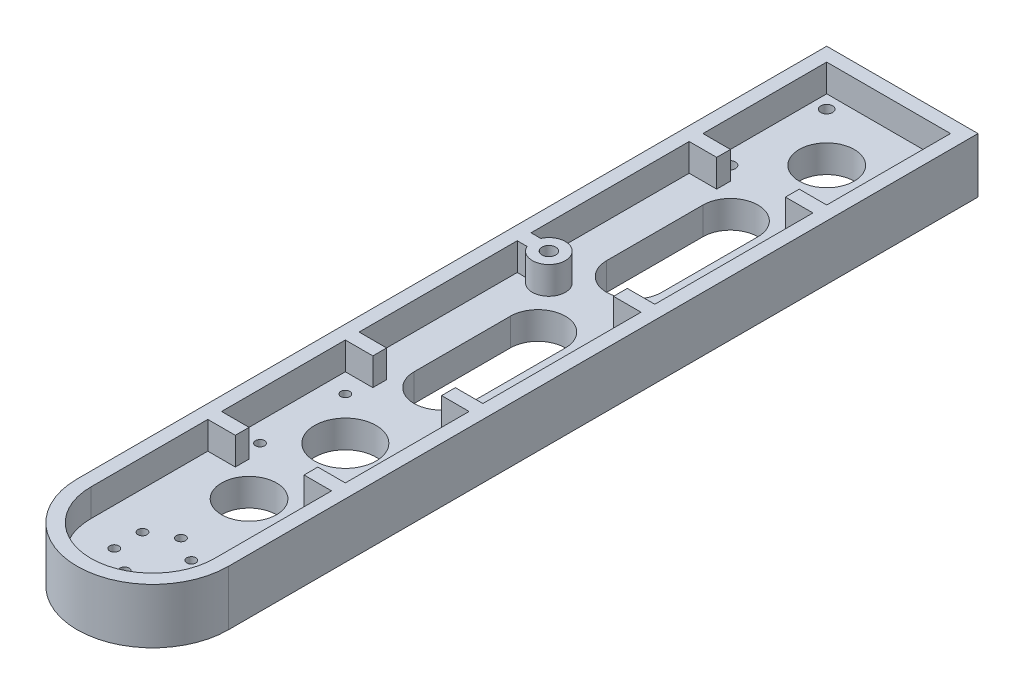
from build123d import *

# Parameters (mm, degrees)
SKETCH_1_R      = 1.65
SKETCH_1_R_2    = 2.15
SKETCH_1_R_3    = 10
SKETCH_1_R_4    = 11.2
SKETCH_1_R_5    = 2.65
EXTRUDE_1_DEPTH = 10
EXTRUDE_2_DEPTH = 10
SKETCH_4_W      = 10
SKETCH_4_H      = 5
SKETCH_4_R      = 2.5
EXTRUDE_3_DEPTH = 10


with BuildPart() as part:
    # 草图1 → 凸台-拉伸1 (new body)
    with BuildSketch(Plane(origin=(0, 0, 0), x_dir=(1, 0, 0), z_dir=(0, 1, 0))):
        with BuildLine():
            Line((-27.5, 0), (-27.5, 272.5))
            Line((-27.5, 272.5), (27.5, 272.5))
            Line((27.5, 272.5), (27.5, 0))
            ThreePointArc((27.5, 0), (0, -27.5), (-27.5, 0))
        make_face()
        with Locations(Location((0, 10.25, 0), (0, 0, 270))):
            Circle(SKETCH_1_R, mode=Mode.SUBTRACT)
        with Locations(Location((8.876760389, 5.125, 0), (0, 0, 270))):
            Circle(SKETCH_1_R, mode=Mode.SUBTRACT)
        with Locations(Location((8.876760389, -5.125, 0), (0, 0, 270))):
            Circle(SKETCH_1_R, mode=Mode.SUBTRACT)
        with Locations(Location((0, -10.25, 0), (0, 0, 270))):
            Circle(SKETCH_1_R, mode=Mode.SUBTRACT)
        with Locations(Location((-8.876760389, -5.125, 0), (0, 0, 270))):
            Circle(SKETCH_1_R, mode=Mode.SUBTRACT)
        with Locations(Location((-8.876760389, 5.125, 0), (0, 0, 270))):
            Circle(SKETCH_1_R, mode=Mode.SUBTRACT)
        with Locations(Location((-17.67766953, 262.67766953, 0), (0, 0, 270))):
            Circle(SKETCH_1_R_2, mode=Mode.SUBTRACT)
        with Locations(Location((17.67766953, 262.67766953, 0), (0, 0, 270))):
            Circle(SKETCH_1_R_2, mode=Mode.SUBTRACT)
        with Locations(Location((17.67766953, 227.32233047, 0), (0, 0, 270))):
            Circle(SKETCH_1_R_2, mode=Mode.SUBTRACT)
        with Locations(Location((-17.67766953, 227.32233047, 0), (0, 0, 270))):
            Circle(SKETCH_1_R_2, mode=Mode.SUBTRACT)
        with Locations(Location((0, 245, 0), (0, 0, 270))):
            Circle(SKETCH_1_R_3, mode=Mode.SUBTRACT)
        with Locations(Location((-15.5, 85.5, 0), (0, 0, 270))):
            Circle(SKETCH_1_R, mode=Mode.SUBTRACT)
        with Locations(Location((15.5, 85.5, 0), (0, 0, 270))):
            Circle(SKETCH_1_R, mode=Mode.SUBTRACT)
        with Locations(Location((15.5, 54.5, 0), (0, 0, 270))):
            Circle(SKETCH_1_R, mode=Mode.SUBTRACT)
        with Locations(Location((-15.5, 54.5, 0), (0, 0, 270))):
            Circle(SKETCH_1_R, mode=Mode.SUBTRACT)
        with Locations(Location((0, 70, 0), (0, 0, 270))):
            Circle(SKETCH_1_R_4, mode=Mode.SUBTRACT)
        with Locations(Location((0, 35, 0), (0, 0, 270))):
            Circle(SKETCH_1_R_3, mode=Mode.SUBTRACT)
        with Locations(Location((-13.5, 157.5, 0), (0, 0, 270))):
            Circle(SKETCH_1_R_5, mode=Mode.SUBTRACT)
        with BuildLine():
            Line((-10, 105), (-10, 140))
            ThreePointArc((-10, 140), (0, 150), (10, 140))
            Line((10, 140), (10, 105))
            ThreePointArc((10, 105), (0, 95), (-10, 105))
        make_face(mode=Mode.SUBTRACT)
        with BuildLine():
            Line((-10, 175), (-10, 210))
            ThreePointArc((-10, 210), (0, 220), (10, 210))
            Line((10, 210), (10, 175))
            ThreePointArc((10, 175), (0, 165), (-10, 175))
        make_face(mode=Mode.SUBTRACT)
    extrude(amount=EXTRUDE_1_DEPTH)

    # 草图2 → 凸台-拉伸2 (add)
    with BuildSketch(Plane(origin=(0, 10, 0), x_dir=(1, 0, 0), z_dir=(0, 1, 0))):
        with BuildLine():
            Line((-27.5, 272.5), (-27.5, 0))
            ThreePointArc((-27.5, 0), (0, -27.5), (27.5, 0))
            Line((27.5, 0), (27.5, 272.5))
            Line((27.5, 272.5), (-27.5, 272.5))
        make_face()
        with BuildLine():
            ThreePointArc((-22.5, 0), (0, -22.5), (22.5, 0))
            Line((22.5, 0), (22.5, 222.5))
            Line((22.5, 222.5), (22.5, 267.5))
            Line((22.5, 267.5), (-22.5, 267.5))
            Line((-22.5, 267.5), (-22.5, 222.5))
            Line((-22.5, 222.5), (-22.5, 0))
        make_face(mode=Mode.SUBTRACT)
    extrude(amount=EXTRUDE_2_DEPTH)

    # 草图4 → 凸台-拉伸3 (add)
    # profile 1 of 8: a face of its own
    with BuildSketch(Plane(origin=(0, 10, 0), x_dir=(1, 0, 0), z_dir=(0, 1, 0))):
        with Locations((-17.5, 95)):
            Rectangle(SKETCH_4_W, SKETCH_4_H)
    # profile 2 of 8: a face of its own
    with BuildSketch(Plane(origin=(0, 10, 0), x_dir=(1, 0, 0), z_dir=(0, 1, 0))):
        with Locations((-17.5, 220)):
            Rectangle(SKETCH_4_W, SKETCH_4_H)
    # profile 3 of 8: a face of its own
    with BuildSketch(Plane(origin=(0, 10, 0), x_dir=(1, 0, 0), z_dir=(0, 1, 0))):
        with Locations((17.5, 220)):
            Rectangle(SKETCH_4_W, SKETCH_4_H)
    # profile 4 of 8: a face of its own
    with BuildSketch(Plane(origin=(0, 10, 0), x_dir=(1, 0, 0), z_dir=(0, 1, 0))):
        with Locations((17.5, 95)):
            Rectangle(SKETCH_4_W, SKETCH_4_H)
    # profile 5 of 8: a face of its own
    with BuildSketch(Plane(origin=(0, 10, 0), x_dir=(1, 0, 0), z_dir=(0, 1, 0))):
        with Locations((-17.5, 45)):
            Rectangle(SKETCH_4_W, SKETCH_4_H)
    # profile 6 of 8: a face of its own
    with BuildSketch(Plane(origin=(0, 10, 0), x_dir=(1, 0, 0), z_dir=(0, 1, 0))):
        with Locations((17.5, 45)):
            Rectangle(SKETCH_4_W, SKETCH_4_H)
    # profile 7 of 8: a face of its own
    with BuildSketch(Plane(origin=(0, 10, 0), x_dir=(1, 0, 0), z_dir=(0, 1, 0))):
        with BuildLine():
            Line((-22.5, 155), (-22.5, 160))
            Line((-22.5, 160), (-18.954356057, 160))
            ThreePointArc((-18.954356057, 160), (-7.5, 157.5), (-18.954356057, 155))
            Line((-18.954356057, 155), (-22.5, 155))
        make_face()
        with Locations(Location((-13.5, 157.5, 0), (0, 0, 90))):
            Circle(SKETCH_4_R, mode=Mode.SUBTRACT)
    # profile 8 of 8: a face of its own
    with BuildSketch(Plane(origin=(0, 10, 0), x_dir=(1, 0, 0), z_dir=(0, 1, 0))):
        with Locations((17.5, 157.5)):
            Rectangle(SKETCH_4_W, SKETCH_4_H)
    extrude(amount=EXTRUDE_3_DEPTH)


solid = part.part
